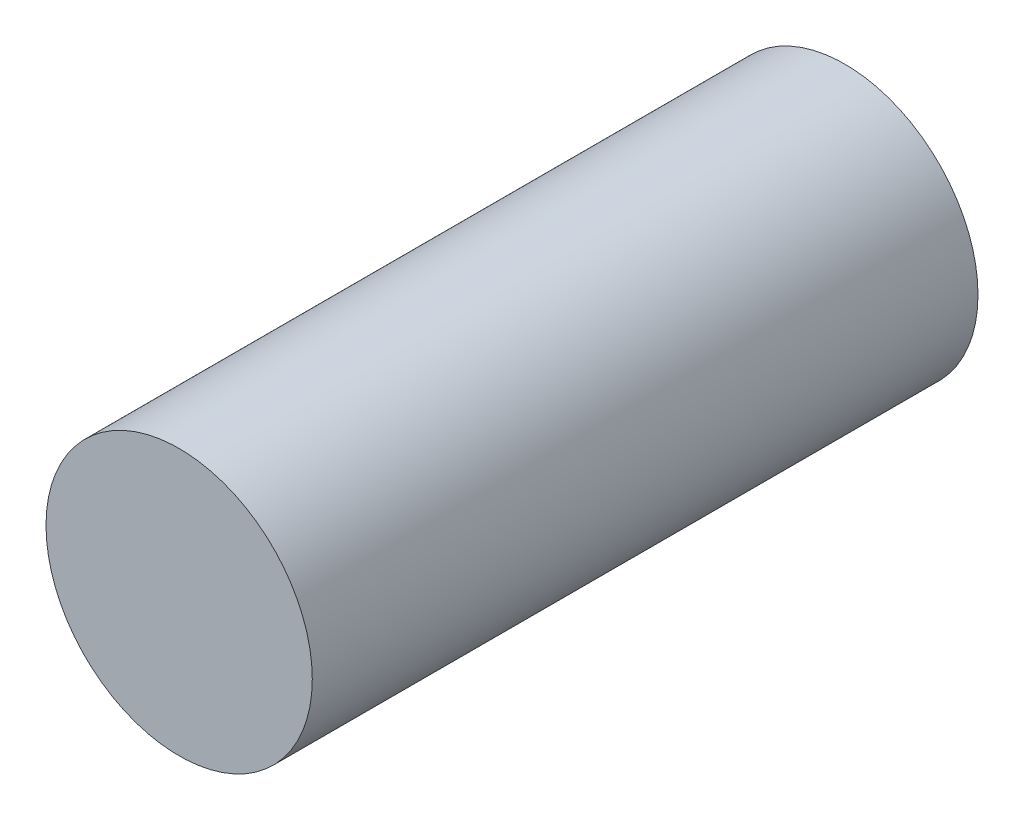
from build123d import *

# Parameters (mm, degrees)
ESQUISSE1_R      = 3
EXTRUSION1_DEPTH = 15


with BuildPart() as part:
    # Esquisse1 → Extrusion1 (new body)
    with BuildSketch(Plane.XY):
        Circle(ESQUISSE1_R)
    extrude(amount=EXTRUSION1_DEPTH)


solid = part.part
